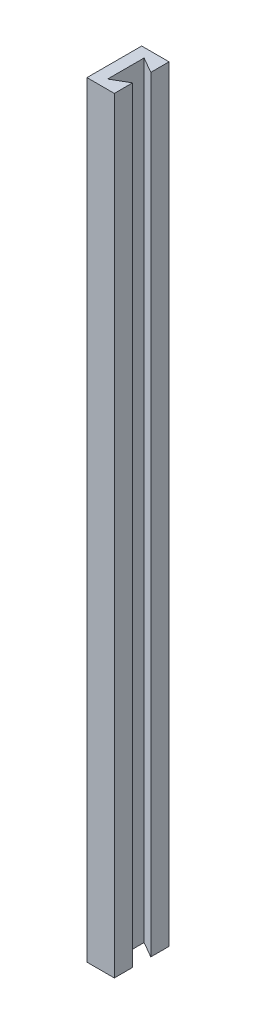
from build123d import *

# Parameters (mm, degrees)
BOSS_EXTRUDE2_DEPTH = 355.6


with BuildPart() as part:
    # Sketch1 → Boss-Extrude2 (new body)
    with BuildSketch(Plane(origin=(0, 0, 0), x_dir=(1, 0, 0), z_dir=(0, 1, 0))):
        Polygon((-28.067579909, 0), (-28.067579909, -25.4), (-15.367579909, -25.4), (-15.367579909, -16.933333333), (-22.699928279, -21.166666582), (-22.699928279, -4.233333249), (-15.367579909, -8.466666667), (-15.367579909, 0), align=None)
    extrude(amount=BOSS_EXTRUDE2_DEPTH)


solid = part.part
